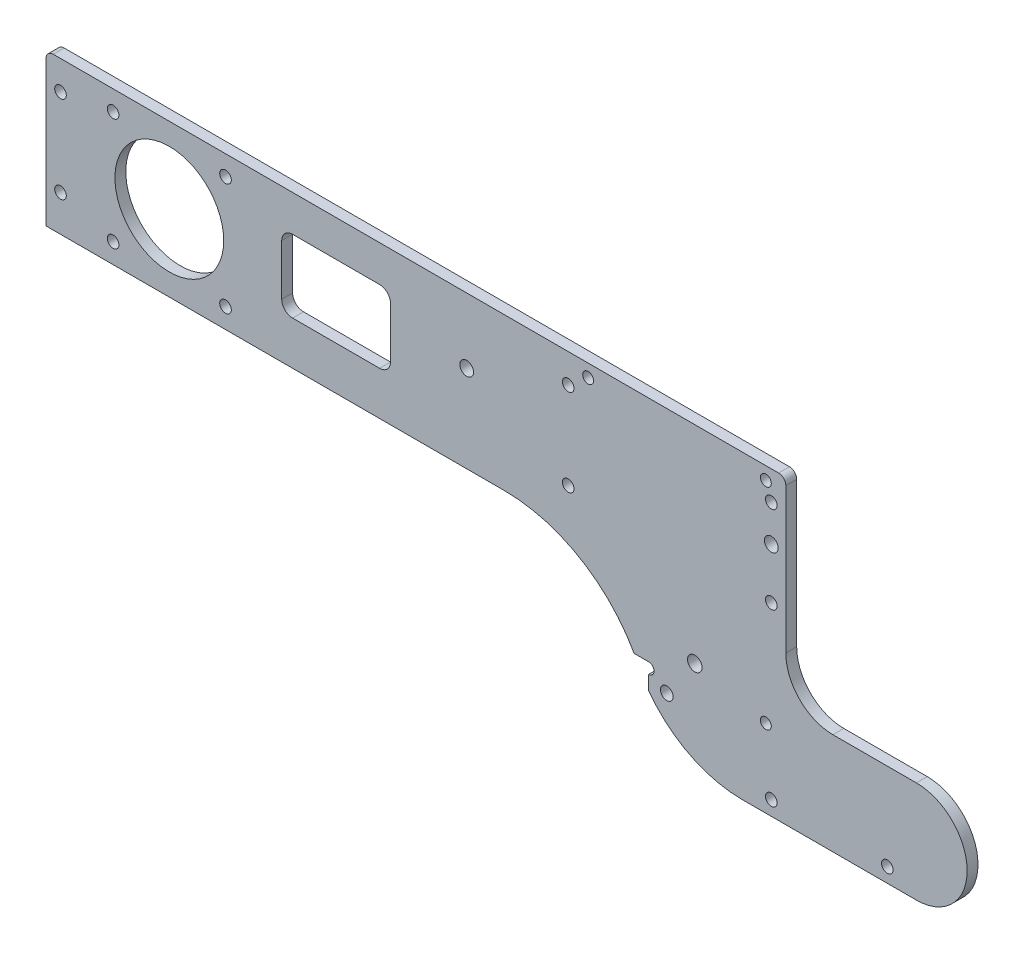
from build123d import *

# Parameters (mm, degrees)
SKETCH_1_R          = 1.6
SKETCH_1_R_2        = 15
EXTRUDE_1_DEPTH     = 3
SKETCH_3_W          = 4
SKETCH_3_H          = 20
CUT_EXTRUDE_2_DEPTH = 10
HOLE_WIZARD_1_D     = 3.5
HOLE_WIZARD_3_D     = 3
HOLE_WIZARD_6_D     = 3.8
HOLE_WIZARD_8_D     = 4
SKETCH_25_W         = 30
SKETCH_25_H         = 20
CUT_EXTRUDE_3_DEPTH = 10
FILLET_1_R          = 3
HOLE_WIZARD_9_D     = 3


with BuildPart() as part:
    # 草图1 → 凸台-拉伸1 (new body)
    with BuildSketch(Plane.XY):
        with BuildLine():
            Line((-34, 0), (-34, 40))
            ThreePointArc((-34, 40), (-33.414213562, 41.414213562), (-32, 42))
            Line((-32, 42), (168, 42))
            ThreePointArc((168, 42), (169.414213562, 41.414213562), (170, 40))
            Line((170, 40), (170, 0))
            ThreePointArc((170, 0), (173.807611845, -9.192388155), (183, -13))
            Line((183, -13), (206, -13))
            ThreePointArc((206, -13), (220, -27), (206, -41))
            Line((206, -41), (158, -41))
            ThreePointArc((158, -41), (141.042357362, -36.137397741), (129.238356686, -23.02739726))
            ThreePointArc((129.238356686, -23.02739726), (114.114480821, -6.230209144), (92.387501191, 0))
            Line((92.387501191, 0), (-34, 0))
        make_face()
        with Locations((15.5, 5.5)):
            Circle(SKETCH_1_R, mode=Mode.SUBTRACT)
        with Locations((-15.5, 5.5)):
            Circle(SKETCH_1_R, mode=Mode.SUBTRACT)
        with Locations((-15.5, 36.5)):
            Circle(SKETCH_1_R, mode=Mode.SUBTRACT)
        with Locations((15.5, 36.5)):
            Circle(SKETCH_1_R, mode=Mode.SUBTRACT)
        with Locations((166, 34)):
            Circle(SKETCH_1_R, mode=Mode.SUBTRACT)
        with Locations((166, 10)):
            Circle(SKETCH_1_R, mode=Mode.SUBTRACT)
        with Locations((-30, 10)):
            Circle(SKETCH_1_R, mode=Mode.SUBTRACT)
        with Locations((-30, 34)):
            Circle(SKETCH_1_R, mode=Mode.SUBTRACT)
        with Locations((0, 21)):
            Circle(SKETCH_1_R_2, mode=Mode.SUBTRACT)
        with Locations((166, -37)):
            Circle(SKETCH_1_R, mode=Mode.SUBTRACT)
        with Locations((198, -37)):
            Circle(SKETCH_1_R, mode=Mode.SUBTRACT)
        with Locations((110, 34)):
            Circle(SKETCH_1_R, mode=Mode.SUBTRACT)
        with Locations((110, 10)):
            Circle(SKETCH_1_R, mode=Mode.SUBTRACT)
    extrude(amount=EXTRUDE_1_DEPTH)

    # 草图3 → 切除-拉伸2 (cut)
    with BuildSketch(Plane.XY.offset(3)):
        with Locations((130.178561527, -31)):
            Rectangle(SKETCH_3_W, SKETCH_3_H)
    extrude(amount=-CUT_EXTRUDE_2_DEPTH, mode=Mode.SUBTRACT)

    # 孔1 (through all)
    with Locations(Plane(origin=(0, 0, 0), x_dir=(-1, 0, 0), z_dir=(0, 0, -1))):
        with Locations((-137.178561527, -26)):
            Hole(HOLE_WIZARD_1_D / 2)

    # 孔3 (through all)
    with Locations(Plane(origin=(0, 0, 0), x_dir=(-1, 0, 0), z_dir=(0, 0, -1))):
        with Locations((-164.5, 38.5), (-115.5, 38.5), (-164.5, -19.5)):
            Hole(HOLE_WIZARD_3_D / 2)

    # 孔6 (through all)
    with Locations(Plane(origin=(0, 0, 0), x_dir=(-1, 0, 0), z_dir=(0, 0, -1))):
        with Locations((-166, 24), (-82, 24)):
            Hole(HOLE_WIZARD_6_D / 2)

    # 孔8 (through all)
    with Locations(Plane(origin=(0, 0, 0), x_dir=(-1, 0, 0), z_dir=(0, 0, -1))):
        with Locations((-144.906, -15.042)):
            Hole(HOLE_WIZARD_8_D / 2)

    # 草图25 → 切除-拉伸3 (cut)
    with BuildSketch(Plane(origin=(0, 0, 0), x_dir=(-1, 0, 0), z_dir=(0, 0, -1))):
        with Locations((-46, 22)):
            Rectangle(SKETCH_25_W, SKETCH_25_H)
    extrude(amount=-CUT_EXTRUDE_3_DEPTH, mode=Mode.SUBTRACT)

    # 圆角1
    fillet_1_edges = [part.edges().sort_by_distance(p)[0] for p in [
        (61, 12, 1.5),
        (61, 32, 1.5),
        (31, 32, 1.5),
        (31, 12, 1.5),
    ]]
    fillet(fillet_1_edges, radius=FILLET_1_R)

    # 孔9 (through all)
    with Locations(Plane(origin=(0, 0, 0), x_dir=(-1, 0, 0), z_dir=(0, 0, -1))):
        with Locations((-132.178561527, -22.5)):
            Hole(HOLE_WIZARD_9_D / 2)


solid = part.part
